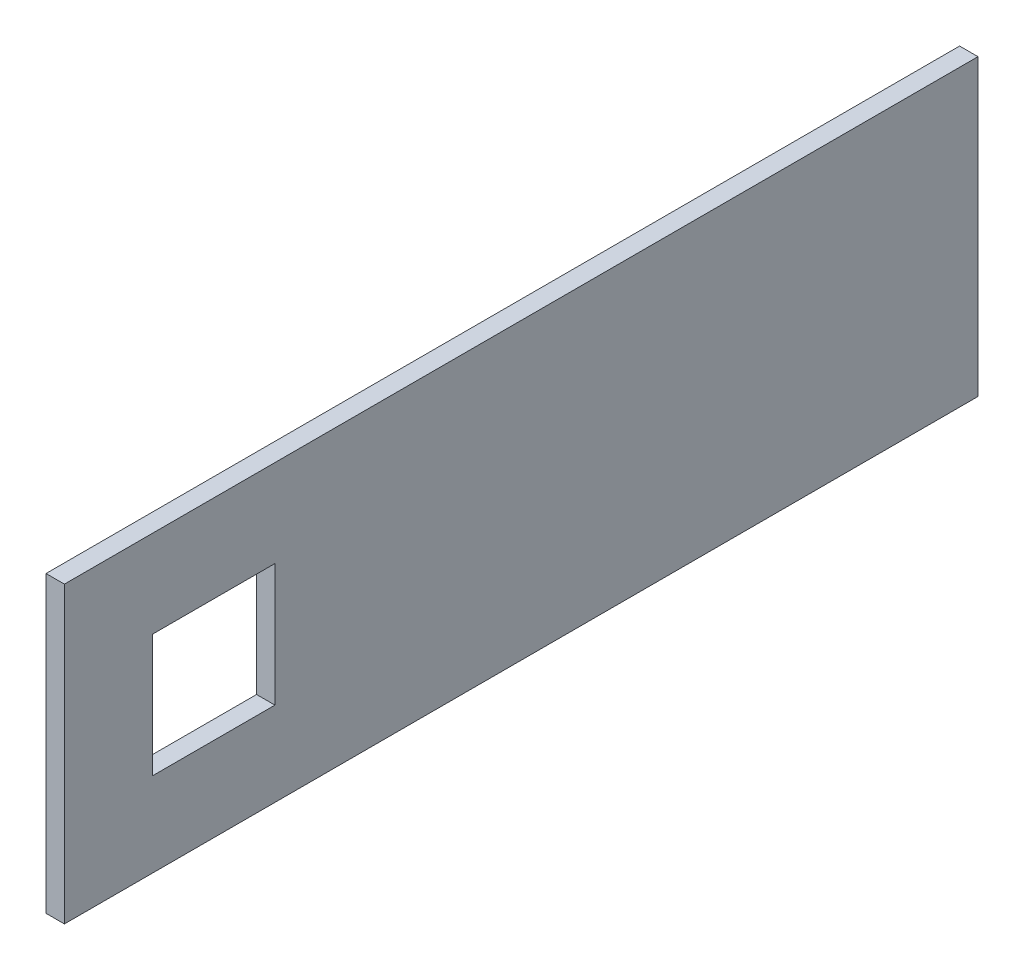
from build123d import *

# Parameters (mm, degrees)
SKETCH1_W           = 149
SKETCH1_H           = 48
SKETCH1_W_2         = 20
SKETCH1_H_2         = 20
BOSS_EXTRUDE2_DEPTH = 3


with BuildPart() as part:
    # Sketch1 → Boss-Extrude2 (new body)
    with BuildSketch(Plane(origin=(0, 0, 0), x_dir=(0, 0, -1), z_dir=(1, 0, 0))):
        Rectangle(SKETCH1_W, SKETCH1_H)
        with Locations((-50.160086438, -0.258581158)):
            Rectangle(SKETCH1_W_2, SKETCH1_H_2, mode=Mode.SUBTRACT)
    extrude(amount=BOSS_EXTRUDE2_DEPTH)


solid = part.part
